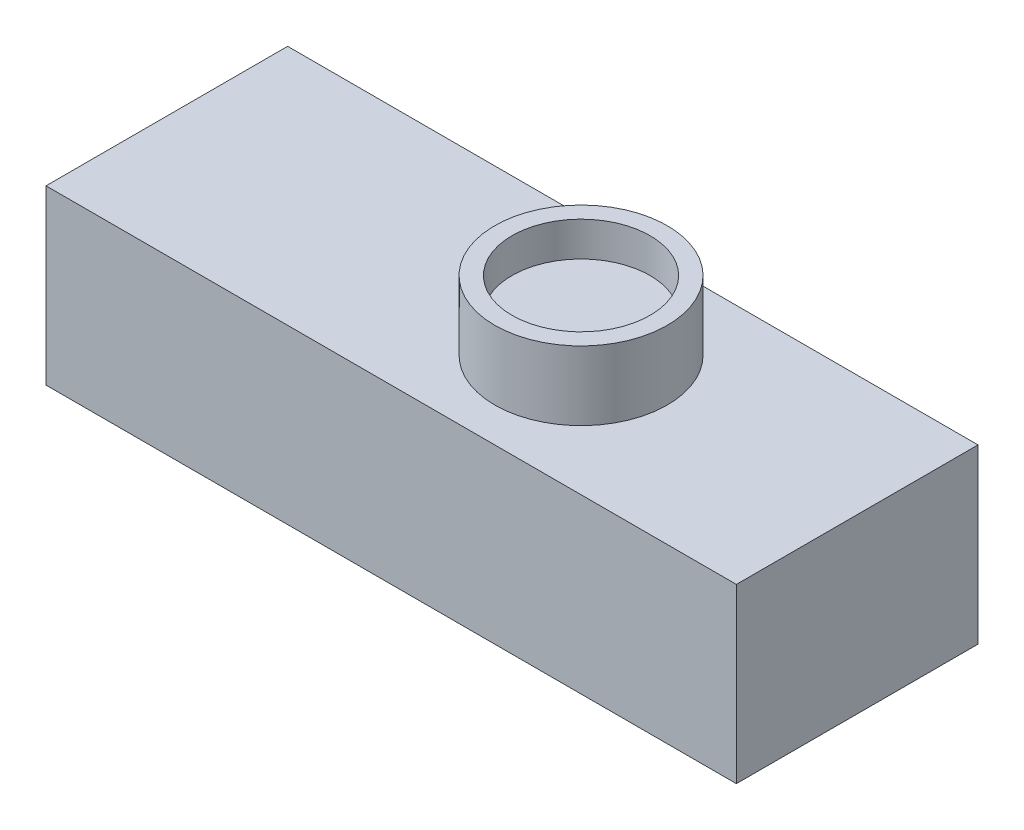
from build123d import *

# Parameters (mm, degrees)
SKETCH1_W           = 20
SKETCH1_H           = 7
BOSS_EXTRUDE1_DEPTH = 5
SKETCH2_R           = 2.5
BOSS_EXTRUDE2_DEPTH = 2
SKETCH3_R           = 2
CUT_EXTRUDE1_DEPTH  = 1


with BuildPart() as part:
    # Sketch1 → Boss-Extrude1 (new body)
    with BuildSketch(Plane(origin=(0, 0, 0), x_dir=(1, 0, 0), z_dir=(0, 1, 0))):
        Rectangle(SKETCH1_W, SKETCH1_H)
    extrude(amount=BOSS_EXTRUDE1_DEPTH)

    # Sketch2 → Boss-Extrude2 (add)
    with BuildSketch(Plane(origin=(0, 5, 0), x_dir=(1, 0, 0), z_dir=(0, 1, 0))):
        with Locations(Location((2, 0, 0), (0, 0, 270))):
            Circle(SKETCH2_R)
    extrude(amount=BOSS_EXTRUDE2_DEPTH)

    # Sketch3 → Cut-Extrude1 (cut)
    with BuildSketch(Plane(origin=(0, 7, 0), x_dir=(1, 0, 0), z_dir=(0, 1, 0))):
        with Locations(Location((2, 0, 0), (0, 0, 270))):
            Circle(SKETCH3_R)
    extrude(amount=-CUT_EXTRUDE1_DEPTH, mode=Mode.SUBTRACT)


solid = part.part
